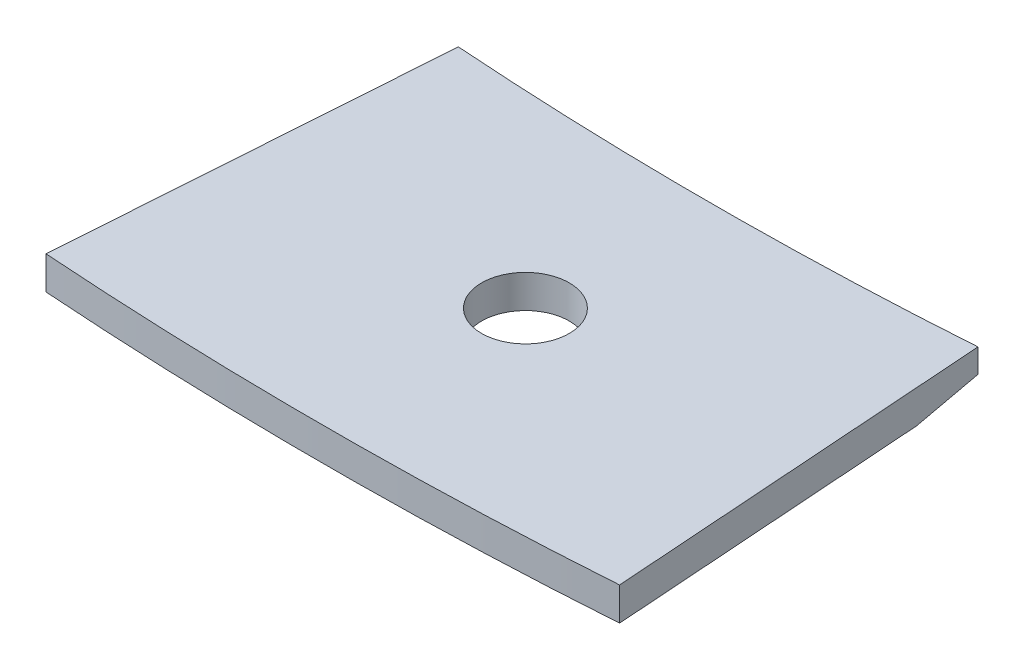
from build123d import *

# Parameters (mm, degrees)
SKETCH2_R           = 2.650000000000004
BOSS_EXTRUDE1_DEPTH = 2
BOSS_EXTRUDE2_DEPTH = 2
CHAMFER1_SIZE       = 4
CHAMFER1_SIZE2      = 0.5621633388095701


with BuildPart() as part:
    # Sketch2 → Boss-Extrude1 (new body)
    with BuildSketch(Plane(origin=(0, 0, 0), x_dir=(1, 0, 0), z_dir=(0, 1, 0))):
        with BuildLine():
            Line((-15.984695958466673, -228.5918021170437), (-17.33448372541018, -247.89466648957097))
            ThreePointArc((-17.33448372541018, -247.89466648957097), (4.98147e-12, -248.50000000000463), (17.334483725420203, -247.89466648957094))
            Line((17.334483725420203, -247.89466648957094), (15.98469595846676, -228.59180211704373))
            ThreePointArc((15.98469595846676, -228.59180211704373), (4.411e-14, -229.150000000005), (-15.984695958466673, -228.5918021170437))
        make_face()
        with Locations(Location((8.9e-16, -236.24999999999997, 0), (0, 0, 270))):
            Circle(SKETCH2_R, mode=Mode.SUBTRACT)
    extrude(amount=BOSS_EXTRUDE1_DEPTH)

    # Sketch3 → Boss-Extrude2 (add)
    with BuildSketch(Plane(origin=(0, 0, 0), x_dir=(1, 0, 0), z_dir=(0, 1, 0))):
        with BuildLine():
            Line((-15.70567006349017, -224.6015459160044), (-15.984695958466673, -228.5918021170437))
            ThreePointArc((-15.984695958466673, -228.5918021170437), (1.403e-14, -229.15000000000495), (15.98469595846676, -228.59180211704367))
            Line((15.98469595846676, -228.59180211704367), (15.705670063490256, -224.60154591600437))
            ThreePointArc((15.705670063490256, -224.60154591600437), (1.379e-14, -225.15000000000495), (-15.70567006349017, -224.6015459160044))
        make_face()
    extrude(amount=BOSS_EXTRUDE2_DEPTH)

    # Chamfer1
    chamfer1_edges = [part.edges().sort_by_distance(p)[0] for p in [
        (4.53e-14, 0, 225.15000000000498),
    ]]
    chamfer1_side = [part.faces().sort_by_distance(p)[0] for p in [
        (5.01431e-12, 0, 248.07892121738644),
    ]]
    chamfer(chamfer1_edges, length=CHAMFER1_SIZE, length2=CHAMFER1_SIZE2, reference=chamfer1_side[0])


solid = part.part
